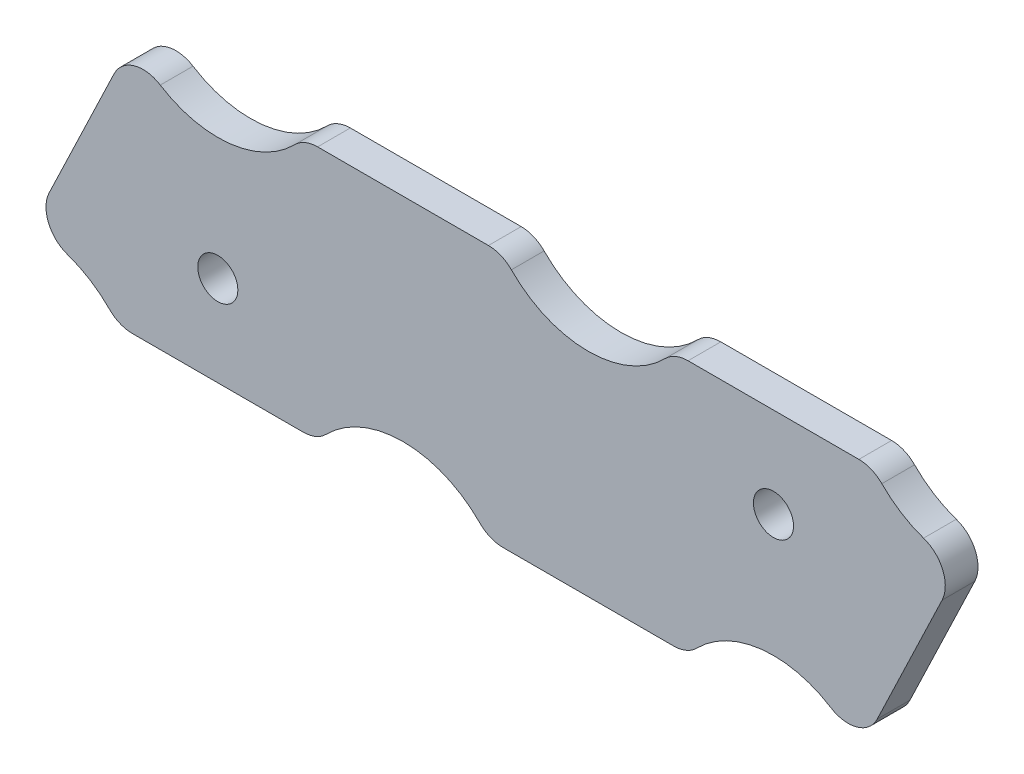
from build123d import *

# Parameters (mm, degrees)
BOSS_EXTRUDE1_DEPTH = 2.032
FILLET1_R           = 2
SKETCH4_R           = 1.2446
CUT_EXTRUDE1_DEPTH  = 75.115872934


with BuildPart() as part:
    # Sketch3 → Boss-Extrude1 (new body)
    with BuildSketch(Plane.XY):
        with BuildLine():
            Line((62.980794963, 30.66873734), (50.569205037, 30.66873734))
            ThreePointArc((50.569205037, 30.66873734), (45.275, 28.075), (39.980794963, 30.66873734))
            Line((39.980794963, 30.66873734), (27.569205037, 30.66873734))
            ThreePointArc((27.569205037, 30.66873734), (22.275, 28.075), (16.980794963, 30.66873734))
            Line((16.980794963, 30.66873734), (10.658308864, 17.473983742))
            ThreePointArc((10.658308864, 17.473983742), (13.670205209, 16.817167392), (16.069205037, 14.88126266))
            Line((16.069205037, 14.88126266), (28.480794963, 14.88126266))
            ThreePointArc((28.480794963, 14.88126266), (33.775, 17.475), (39.069205037, 14.88126266))
            Line((39.069205037, 14.88126266), (51.480794963, 14.88126266))
            ThreePointArc((51.480794963, 14.88126266), (56.775, 17.475), (62.069205037, 14.88126266))
            Line((62.069205037, 14.88126266), (68.391691136, 28.076016258))
            ThreePointArc((68.391691136, 28.076016258), (65.379794791, 28.732832608), (62.980794963, 30.66873734))
        make_face()
    extrude(amount=BOSS_EXTRUDE1_DEPTH)

    # Fillet1
    fillet1_edges = [part.edges().sort_by_distance(p)[0] for p in [
        (68.391691136, 28.076016258, 1.016),
        (62.069205037, 14.88126266, 1.016),
        (51.480794963, 14.88126266, 1.016),
        (39.069205037, 14.88126266, 1.016),
        (28.480794963, 14.88126266, 1.016),
        (16.069205037, 14.88126266, 1.016),
        (10.658308864, 17.473983742, 1.016),
        (16.980794963, 30.66873734, 1.016),
        (27.569205037, 30.66873734, 1.016),
        (39.980794963, 30.66873734, 1.016),
        (50.569205037, 30.66873734, 1.016),
        (62.980794963, 30.66873734, 1.016),
    ]]
    fillet(fillet1_edges, radius=FILLET1_R)

    # Sketch4 → Cut-Extrude1 (cut, through all)
    with BuildSketch(Plane.XY.offset(2.032)):
        with Locations((22.275, 20.49206771)):
            Circle(SKETCH4_R)
        with Locations((56.775, 25.05793229)):
            Circle(SKETCH4_R)
    extrude(amount=-CUT_EXTRUDE1_DEPTH, mode=Mode.SUBTRACT)


solid = part.part
